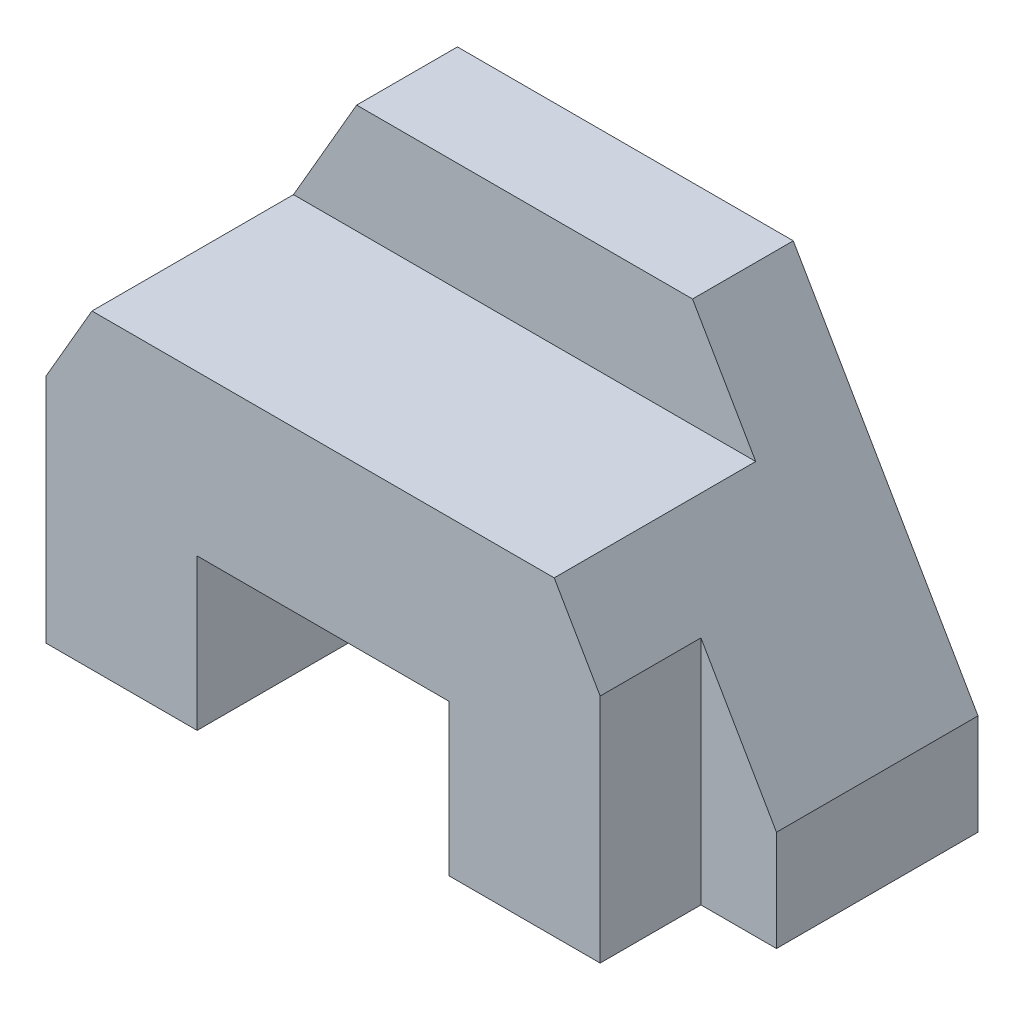
from build123d import *

# Parameters (mm, degrees)
BOSS_EXTRUDE1_DEPTH     = 914.4
SKETCH2_W               = 228.6
SKETCH2_H               = 304.8
CUT_EXTRUDE1_DEPTH      = 1894.961351242
CUT_EXTRUDE2_DEPTH      = 1894.961351242
CUT_EXTRUDE2_DEPTH_BACK = 1894.961351242
SKETCH3_W               = 609.6
SKETCH3_H               = 330.2


with BuildPart() as part:
    # Sketch1 → Boss-Extrude1 (new body)
    with BuildSketch(Plane.XY):
        Polygon((-381, 0), (-381, 457.2), (381, 457.2), (381, 0), (1066.8, 0), (1066.8, 304.8), (508, 1270), (-508, 1270), (-1066.8, 304.8), (-1066.8, 0), align=None)
    extrude(amount=-BOSS_EXTRUDE1_DEPTH)

    # Sketch2 → Cut-Extrude1 (cut, through all)
    with BuildSketch(Plane(origin=(0, 0, 0), x_dir=(1, 0, 0), z_dir=(0, 1, 0))):
        with Locations((-952.5, 152.4)):
            Rectangle(SKETCH2_W, SKETCH2_H)
        with Locations((952.5, 152.4)):
            Rectangle(SKETCH2_W, SKETCH2_H)
    extrude(amount=CUT_EXTRUDE1_DEPTH, mode=Mode.SUBTRACT)

    # Sketch3 → Cut-Extrude2 (cut, two sides: drawn at the far end of the back side and taken through both)
    with BuildSketch(Plane(origin=(0, 0, 0), x_dir=(0, 0, -1), z_dir=(1, 0, 0)).offset(-CUT_EXTRUDE2_DEPTH_BACK)):
        with Locations((304.8, 1104.9)):
            Rectangle(SKETCH3_W, SKETCH3_H)
    extrude(amount=CUT_EXTRUDE2_DEPTH + CUT_EXTRUDE2_DEPTH_BACK, mode=Mode.SUBTRACT)


solid = part.part
